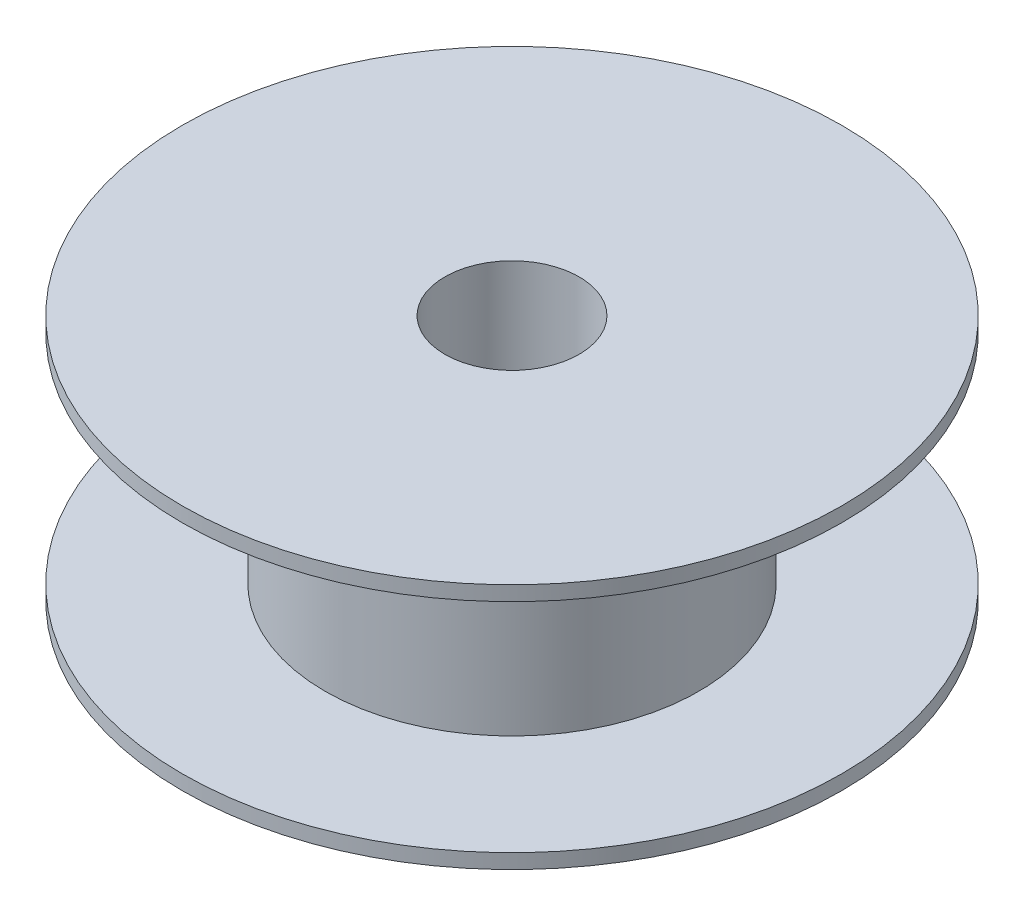
from build123d import *

# Parameters (mm, degrees)
SKETCH2_R          = 27.5
CUT_EXTRUDE1_DEPTH = 260


with BuildPart() as part:
    # Sketch1 → Revolve1 (revolve)
    with BuildSketch(Plane.XY, mode=Mode.PRIVATE) as revolve1_sk:
        Polygon((-135, 95), (-135, 101), (0, 101), (0, 0), (-135, 0), (-135, 6), (-76.5, 6), (-76.5, 95), align=None)
    revolve(revolve1_sk.sketch.rotate(Axis((0, 0, 0), (0, 1, 0)), 270), axis=Axis((0, 0, 0), (0, 1, 0)))

    # Sketch2 → Cut-Extrude1 (cut)
    with BuildSketch(Plane(origin=(0, 101, 0), x_dir=(1, 0, 0), z_dir=(0, 1, 0))):
        with Locations(Location((0, 0, 0), (0, 0, 270))):
            Circle(SKETCH2_R)
    extrude(amount=-CUT_EXTRUDE1_DEPTH, mode=Mode.SUBTRACT)


solid = part.part
